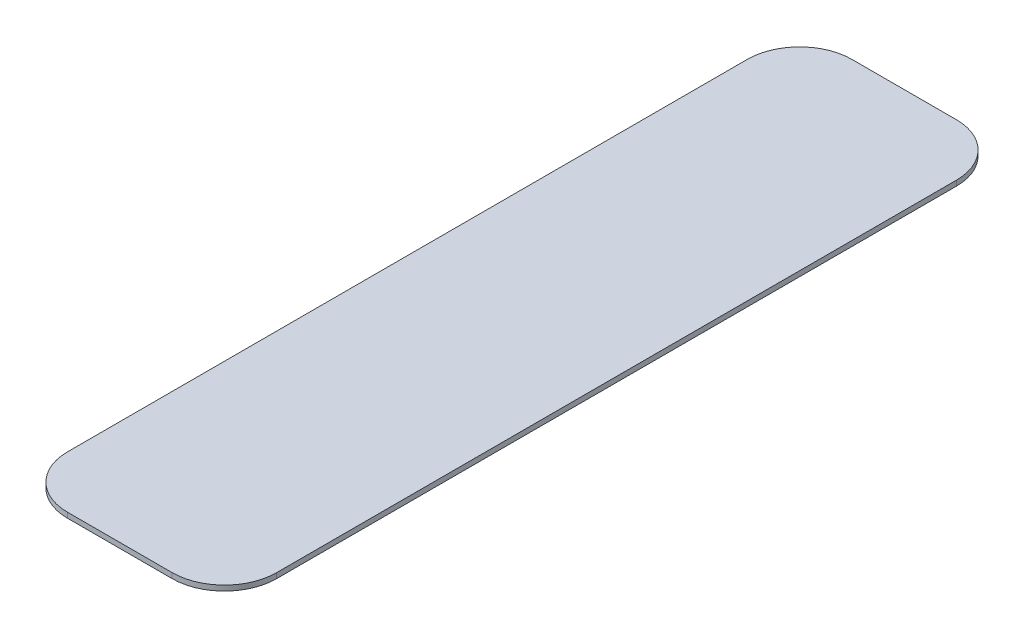
from build123d import *

# Parameters (mm, degrees)
SKETCH1_W           = 8
SKETCH1_H           = 0.2
BOSS_EXTRUDE1_DEPTH = 15
FILLET1_R           = 2


with BuildPart() as part:
    # Sketch1 → Boss-Extrude1 (new, symmetric)
    with BuildSketch(Plane.XY):
        Rectangle(SKETCH1_W, SKETCH1_H)
    extrude(amount=BOSS_EXTRUDE1_DEPTH, both=True)

    # Fillet1
    fillet1_edges = [part.edges().sort_by_distance(p)[0] for p in [
        (4, 0, 15),
        (-4, 0, 15),
        (4, 0, -15),
        (-4, 0, -15),
    ]]
    fillet(fillet1_edges, radius=FILLET1_R)


solid = part.part
